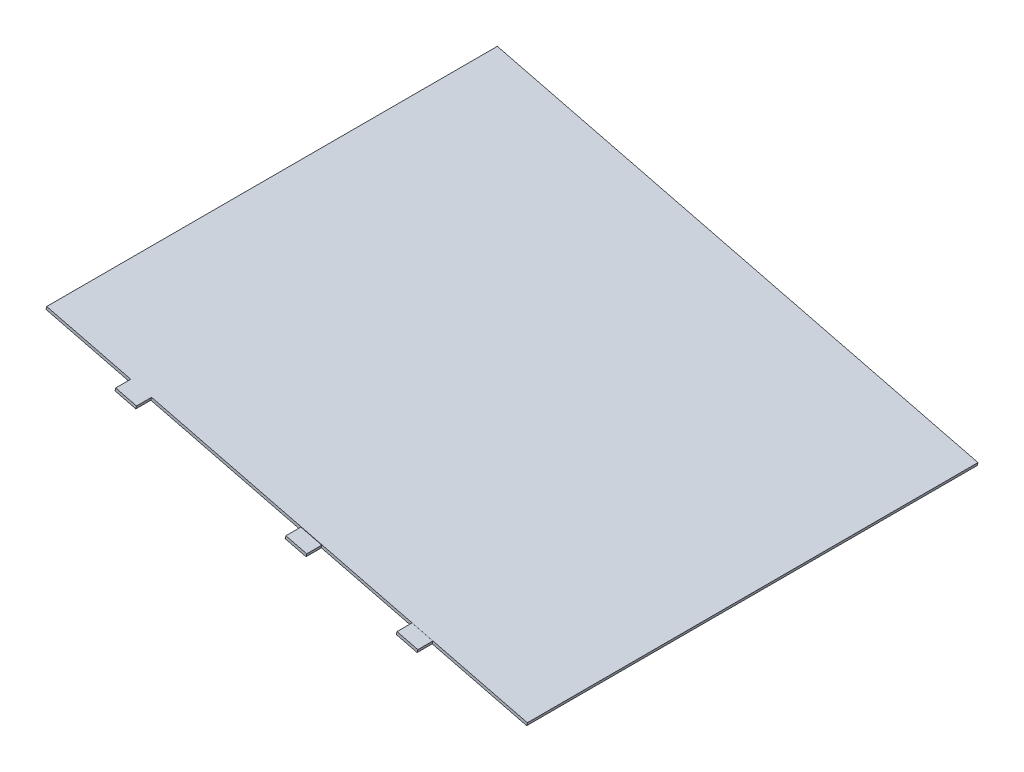
from build123d import *

# Parameters (mm, degrees)
EXTRUDE_1_DEPTH = 1500
EXTRUDE_2_DEPTH = 50
EXTRUDE_5_DEPTH = 50
EXTRUDE_6_DEPTH = 50


with BuildPart() as part:
    # 草图2 → 拉伸-薄壁1 (new body)
    with BuildSketch(Plane.XY):
        Polygon((-2057.941251584, 400), (-457.941251584, 0), (-460.366607835, -9.701425001), (-2060.366607835, 390.298574999), align=None)
    extrude(amount=EXTRUDE_1_DEPTH)

    # 草图3 → 凸台-拉伸2 (add)
    with BuildSketch(Plane.XY.offset(1500)):
        Polygon((-1778.296514005, 330.088815605), (-1780.721870255, 320.387390604), (-1711.309316368, 303.034252132), (-1708.883960117, 312.735677133), align=None)
    extrude(amount=EXTRUDE_2_DEPTH)

    # 草图8 → 凸台-拉伸5 (add)
    with BuildSketch(Plane.XY.offset(1500)):
        Polygon((-841.962523584, 95.770350875), (-844.387879834, 86.068925873), (-774.975325947, 68.715787402), (-772.549969697, 78.417212403), align=None)
    extrude(amount=EXTRUDE_5_DEPTH)

    # 草图9 → 凸台-拉伸6 (add)
    with BuildSketch(Plane.XY.offset(1500)):
        Polygon((-1211.830765034, 187.137147041), (-1214.256121285, 177.435722039), (-1144.843567398, 160.082583568), (-1142.418211147, 169.784008569), align=None)
    extrude(amount=EXTRUDE_6_DEPTH)


solid = part.part
